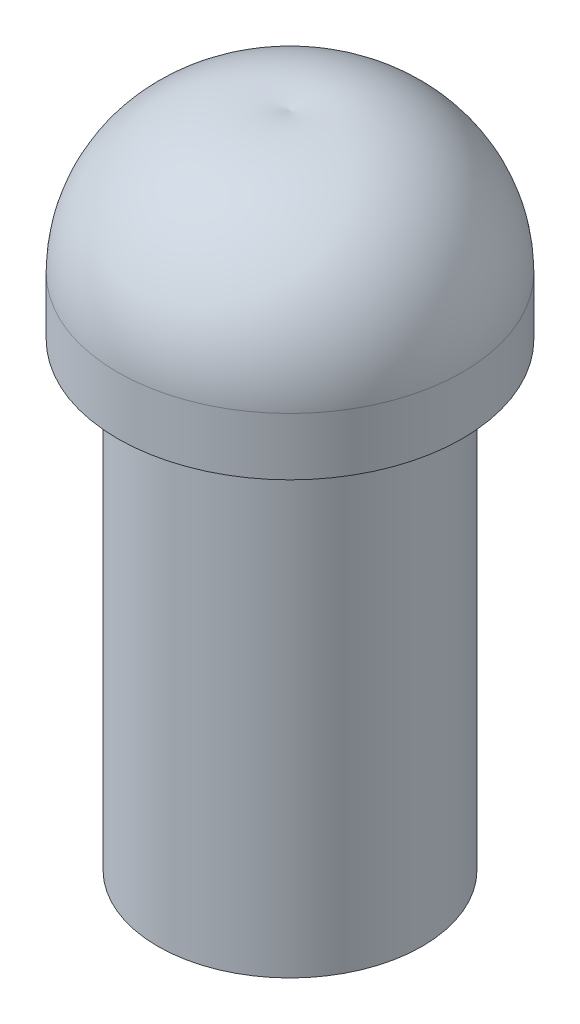
from build123d import *


with BuildPart() as part:
    # Sketch1 → Revolve1 (revolve)
    with BuildSketch(Plane.XY):
        with BuildLine():
            Line((-3, 3.11209092), (-2.3, 3.11209092))
            Line((-2.3, 3.11209092), (-2.3, -4.88790908))
            Line((-2.3, -4.88790908), (-1.55, -4.88790908))
            Line((-1.55, -4.88790908), (-1.55, 2.262295082))
            Line((-1.55, 2.262295082), (0, 2.262295082))
            Line((0, 2.262295082), (0, 6.561580663))
            ThreePointArc((0, 6.561580663), (-2.08113883, 6.048582593), (-3, 4.11209092))
            Line((-3, 4.11209092), (-3, 3.11209092))
        make_face()
    revolve(axis=Axis((0, 6.561580663, 0), (0, -1, 0)))


solid = part.part
